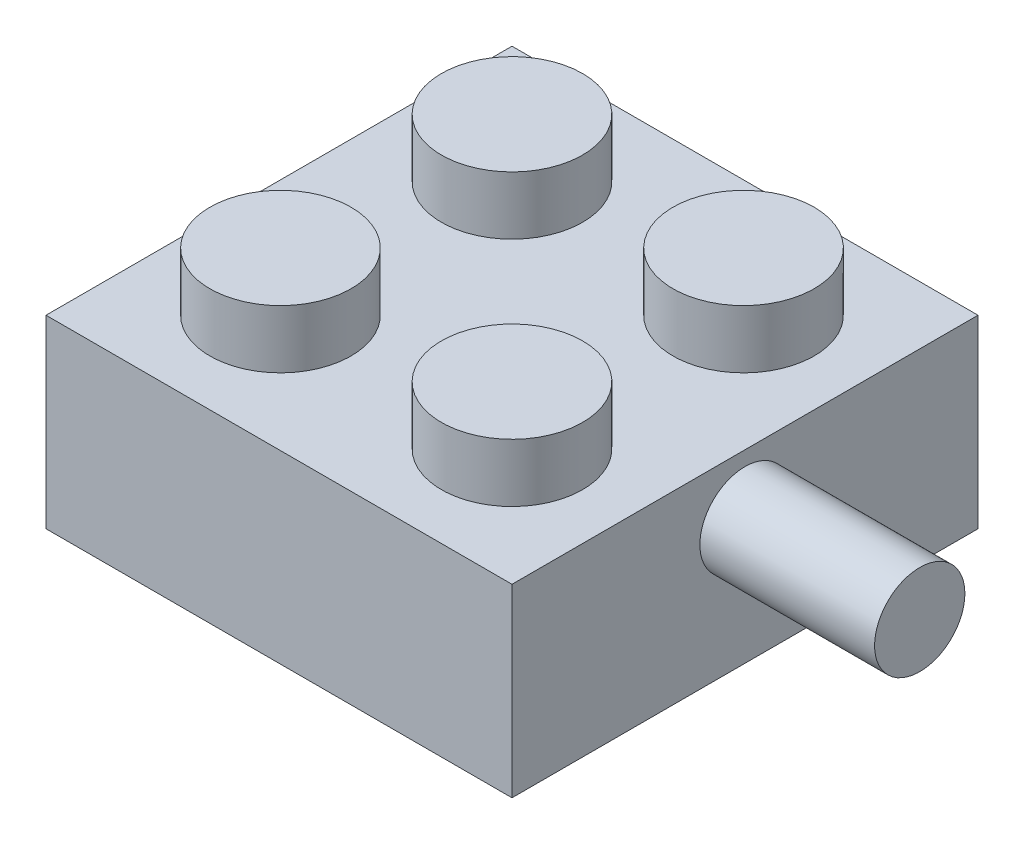
from build123d import *

# Parameters (mm, degrees)
SKETCH1_W           = 16
SKETCH1_H           = 16
BOSS_EXTRUDE1_DEPTH = 6.35
BOSS_EXTRUDE2_START = 6.35
SKETCH1_3_R         = 2.425
BOSS_EXTRUDE2_DEPTH = 2
SKETCH2_R           = 1.55
BOSS_EXTRUDE3_DEPTH = 6


with BuildPart() as part:
    # Sketch1 → Boss-Extrude1 (new body)
    with BuildSketch(Plane(origin=(0, 0, 0), x_dir=(1, 0, 0), z_dir=(0, 1, 0))):
        Rectangle(SKETCH1_W, SKETCH1_H)
    extrude(amount=BOSS_EXTRUDE1_DEPTH)

    # Sketch1<3> → Boss-Extrude2 (add)
    with BuildSketch(Plane(origin=(0, 0, 0), x_dir=(1, 0, 0), z_dir=(0, 1, 0)).offset(BOSS_EXTRUDE2_START)):
        with Locations(Location((-3.975, -3.975, 0), (0, 0, 90))):
            Circle(SKETCH1_3_R)
        with Locations(Location((3.975, -3.975, 0), (0, 0, 90))):
            Circle(SKETCH1_3_R)
        with Locations(Location((3.975, 3.975, 0), (0, 0, 90))):
            Circle(SKETCH1_3_R)
        with Locations(Location((-3.975, 3.975, 0), (0, 0, 90))):
            Circle(SKETCH1_3_R)
    extrude(amount=BOSS_EXTRUDE2_DEPTH)

    # Sketch2 → Boss-Extrude3 (add)
    with BuildSketch(Plane(origin=(8, 0, 0), x_dir=(0, 0, -1), z_dir=(1, 0, 0))):
        with Locations((0, 4.3)):
            Circle(SKETCH2_R)
    extrude(amount=BOSS_EXTRUDE3_DEPTH)


solid = part.part
